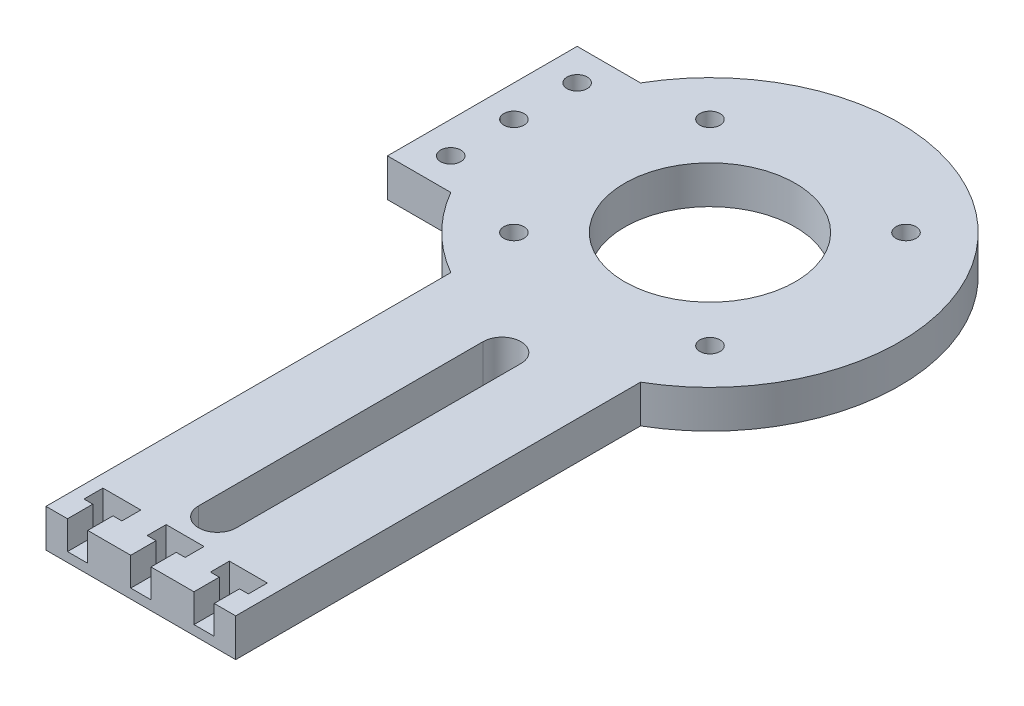
from build123d import *

# Parameters (mm, degrees)
SKETCH_1_R          = 1.6
SKETCH_1_R_2        = 13.5
EXTRUDE_1_DEPTH     = 6
SKETCH_3_W          = 10
SKETCH_3_H          = 30
SKETCH_3_R          = 1.6
EXTRUDE_2_DEPTH     = 6
SKETCH_7_W          = 3.2
SKETCH_7_H          = 4
CUT_EXTRUDE_3_DEPTH = 14.5
SKETCH_8_W          = 6
SKETCH_8_H          = 3
CUT_EXTRUDE_4_DEPTH = 14.5
SKETCH_10_W         = 23.31764578
SKETCH_10_H         = 4
EXTRUDE_3_DEPTH     = 1.5
SKETCH_11_R         = 1.6
CUT_EXTRUDE_5_DEPTH = 10


with BuildPart() as part:
    # 草图1 → 凸台-拉伸1 (new body)
    with BuildSketch(Plane(origin=(0, 0, 0), x_dir=(1, 0, 0), z_dir=(0, 1, 0))):
        with BuildLine():
            Line((0, 64.019237886), (0, 0))
            Line((0, 0), (30, 0))
            Line((30, 0), (30, 64.019237886))
            ThreePointArc((30, 64.019237886), (15, 120), (0, 64.019237886))
        make_face()
        with BuildLine():
            ThreePointArc((12, 57.113903717), (15, 60.113903717), (18, 57.113903717))
            Line((18, 57.113903717), (18, 12.113903717))
            ThreePointArc((18, 12.113903717), (15, 9.113903717), (12, 12.113903717))
            Line((12, 12.113903717), (12, 57.113903717))
        make_face(mode=Mode.SUBTRACT)
        with Locations(Location((-0.5, 74.5, 0), (0, 0, 270))):
            Circle(SKETCH_1_R, mode=Mode.SUBTRACT)
        with Locations(Location((15, 90, 0), (0, 0, 270))):
            Circle(SKETCH_1_R_2, mode=Mode.SUBTRACT)
        with Locations(Location((30.5, 74.5, 0), (0, 0, 270))):
            Circle(SKETCH_1_R, mode=Mode.SUBTRACT)
        with Locations(Location((30.5, 105.5, 0), (0, 0, 270))):
            Circle(SKETCH_1_R, mode=Mode.SUBTRACT)
        with Locations(Location((-0.5, 105.5, 0), (0, 0, 270))):
            Circle(SKETCH_1_R, mode=Mode.SUBTRACT)
    extrude(amount=EXTRUDE_1_DEPTH)

    # 草图3 → 凸台-拉伸2 (add)
    with BuildSketch(Plane(origin=(0, 6, 0), x_dir=(1, 0, 0), z_dir=(0, 1, 0))):
        with Locations((-16, 90)):
            Rectangle(SKETCH_3_W, SKETCH_3_H)
        with Locations(Location((-16, 80, 0), (0, 0, 90))):
            Circle(SKETCH_3_R, mode=Mode.SUBTRACT)
        with Locations((-16, 90)):
            Circle(SKETCH_3_R, mode=Mode.SUBTRACT)
        with Locations(Location((-16, 100, 0), (0, 0, 90))):
            Circle(SKETCH_3_R, mode=Mode.SUBTRACT)
    extrude(amount=-EXTRUDE_2_DEPTH)

    # 草图7 → 切除-拉伸3 (cut)
    with BuildSketch(Plane.XZ):
        with Locations((25, -2)):
            Rectangle(SKETCH_7_W, SKETCH_7_H)
        with Locations((15, -2)):
            Rectangle(SKETCH_7_W, SKETCH_7_H)
        with Locations((5, -2)):
            Rectangle(SKETCH_7_W, SKETCH_7_H)
    extrude(amount=-CUT_EXTRUDE_3_DEPTH, mode=Mode.SUBTRACT)

    # 草图8 → 切除-拉伸4 (cut)
    with BuildSketch(Plane.XZ):
        with Locations((5, -5.5)):
            Rectangle(SKETCH_8_W, SKETCH_8_H)
        with Locations((15, -5.5)):
            Rectangle(SKETCH_8_W, SKETCH_8_H)
        with Locations((25, -5.5)):
            Rectangle(SKETCH_8_W, SKETCH_8_H)
    extrude(amount=-CUT_EXTRUDE_4_DEPTH, mode=Mode.SUBTRACT)

    # 草图10 → 凸台-拉伸3 (add)
    with BuildSketch(Plane.XZ):
        with Locations((15.05882289, -2)):
            Rectangle(SKETCH_10_W, SKETCH_10_H)
    extrude(amount=-EXTRUDE_3_DEPTH)

    # 草图11 → 切除-拉伸5 (cut)
    with BuildSketch(Plane(origin=(0, 6, 0), x_dir=(1, 0, 0), z_dir=(0, 1, 0))):
        with Locations(Location((-16, 90, 0), (0, 0, 90))):
            Circle(SKETCH_11_R)
    extrude(amount=-CUT_EXTRUDE_5_DEPTH, mode=Mode.SUBTRACT)


solid = part.part
